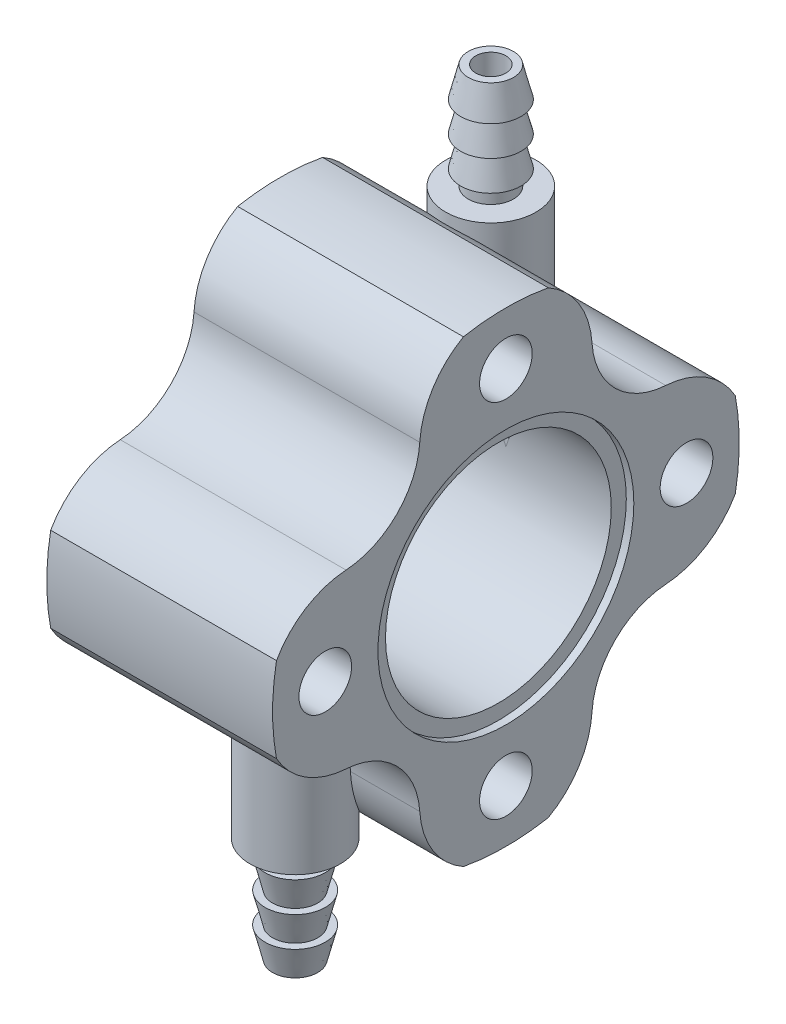
from build123d import *

# Parameters (mm, degrees)
SKETCH2_R           = 1.75
SKETCH2_R_2         = 7.5
FLANGE_DEPTH        = 15
SKETCH3_R           = 8.5
O_RING_SEAT_DEPTH   = 0.5
SKETCH5_R           = 1
OUTLET_DEPTH        = 27.561249971
BOSS_EXTRUDE2_REACH = 39.766
SKETCH6_R           = 3
SKETCH6_R_2         = 1
CIRPATTERN1_COUNT   = 2


with BuildPart() as part:
    # Sketch2 → Flange (new body)
    with BuildSketch(Plane(origin=(0, 0, 0), x_dir=(0, 0, -1), z_dir=(1, 0, 0))):
        with BuildLine():
            ThreePointArc((-15.241152619, 2.820862781), (-15.5, 0), (-15.241152619, -2.820862781))
            ThreePointArc((-15.241152619, -2.820862781), (-13.297993041, -4.855781062), (-10.620697085, -5.721141055))
            ThreePointArc((-10.620697085, -5.721141055), (-7.247844507, -7.247844507), (-5.721141055, -10.620697085))
            ThreePointArc((-5.721141055, -10.620697085), (-4.855781062, -13.297993041), (-2.820862781, -15.241152619))
            ThreePointArc((-2.820862781, -15.241152619), (0, -15.5), (2.820862781, -15.241152619))
            ThreePointArc((2.820862781, -15.241152619), (4.855781062, -13.297993041), (5.721141055, -10.620697085))
            ThreePointArc((5.721141055, -10.620697085), (7.247844507, -7.247844507), (10.620697085, -5.721141055))
            ThreePointArc((10.620697085, -5.721141055), (13.297993041, -4.855781062), (15.241152619, -2.820862781))
            ThreePointArc((15.241152619, -2.820862781), (15.5, 0), (15.241152619, 2.820862781))
            ThreePointArc((15.241152619, 2.820862781), (13.297993041, 4.855781062), (10.620697085, 5.721141055))
            ThreePointArc((10.620697085, 5.721141055), (7.247844507, 7.247844507), (5.721141055, 10.620697085))
            ThreePointArc((5.721141055, 10.620697085), (4.855781062, 13.297993041), (2.820862781, 15.241152619))
            ThreePointArc((2.820862781, 15.241152619), (0, 15.5), (-2.820862781, 15.241152619))
            ThreePointArc((-2.820862781, 15.241152619), (-4.855781062, 13.297993041), (-5.721141055, 10.620697085))
            ThreePointArc((-5.721141055, 10.620697085), (-7.247844507, 7.247844507), (-10.620697085, 5.721141055))
            ThreePointArc((-10.620697085, 5.721141055), (-13.297993041, 4.855781062), (-15.241152619, 2.820862781))
        make_face()
        with Locations((0, 12)):
            Circle(SKETCH2_R, mode=Mode.SUBTRACT)
        with Locations((12, 0)):
            Circle(SKETCH2_R, mode=Mode.SUBTRACT)
        with Locations((0, -12)):
            Circle(SKETCH2_R, mode=Mode.SUBTRACT)
        with Locations((-12, 0)):
            Circle(SKETCH2_R, mode=Mode.SUBTRACT)
        Circle(SKETCH2_R_2, mode=Mode.SUBTRACT)
    extrude(amount=FLANGE_DEPTH)

    # Sketch3 → O-Ring Seat (cut)
    with BuildSketch(Plane(origin=(15, 0, 0), x_dir=(0, 0, -1), z_dir=(1, 0, 0))):
        Circle(SKETCH3_R)
    o_ring_seat = extrude(amount=-O_RING_SEAT_DEPTH, mode=Mode.SUBTRACT)

    # Mirror1: O-Ring Seat across plane
    add(o_ring_seat.mirror(Plane.ZY.offset(-7.5)), mode=Mode.SUBTRACT)

    # Sketch5 → Outlet (cut, through all)
    with BuildSketch(Plane(origin=(0, 0, 0), x_dir=(1, 0, 0), z_dir=(0, 1, 0))):
        with Locations(Location((7.5, 6.5, 0), (0, 0, 90))):
            Circle(SKETCH5_R)
    outlet = extrude(amount=OUTLET_DEPTH, mode=Mode.SUBTRACT)

    # Sketch6 → Boss-Extrude2 (add, up to next)
    with BuildSketch(Plane(origin=(0, 15.5, 0), x_dir=(1, 0, 0), z_dir=(0, 1, 0)), mode=Mode.PRIVATE) as boss_extrude2_sk1:
        with Locations(Location((7.5, 6.5, 0), (0, 0, 270))):
            Circle(SKETCH6_R)
        with Locations(Location((7.5, 6.5, 0), (0, 0, 90))):
            Circle(SKETCH6_R_2, mode=Mode.SUBTRACT)
    boss_extrude2_tool1 = extrude(boss_extrude2_sk1.sketch, amount=-BOSS_EXTRUDE2_REACH, mode=Mode.PRIVATE) - part.part
    boss_extrude2 = boss_extrude2_tool1.solids().sort_by_distance((7.5, 15.5, -9.415147))[0]
    add(boss_extrude2)

    # Sketch8 → Revolve1 (revolve)
    with BuildSketch(Plane.ZY.offset(-7.5), mode=Mode.PRIVATE) as revolve1_sk:
        Polygon((-8, 15.5), (-8, 16.5), (-8.5, 16.5), (-8, 18.5), (-8.5, 18.5), (-8, 20.5), (-8.5, 20.5), (-8, 22.5), (-7.5, 22.5), (-7.5, 15.5), align=None)
    revolve1 = revolve(revolve1_sk.sketch.rotate(Axis((7.5, 15.5, -6.5), (0, -1, 0)), 180), axis=Axis((7.5, 15.5, -6.5), (0, -1, 0)))

    # CirPattern1: Outlet, Boss-Extrude2, Revolve1 ×2 about axis
    cirpattern1_axis = Axis((0.5, 0, 0), (-1, 0, 0))
    add([outlet.rotate(cirpattern1_axis, i * 360 / CIRPATTERN1_COUNT) for i in range(1, CIRPATTERN1_COUNT)], mode=Mode.SUBTRACT)
    add([boss_extrude2.rotate(cirpattern1_axis, i * 360 / CIRPATTERN1_COUNT) for i in range(1, CIRPATTERN1_COUNT)])
    add([revolve1.rotate(cirpattern1_axis, i * 360 / CIRPATTERN1_COUNT) for i in range(1, CIRPATTERN1_COUNT)])


solid = part.part
